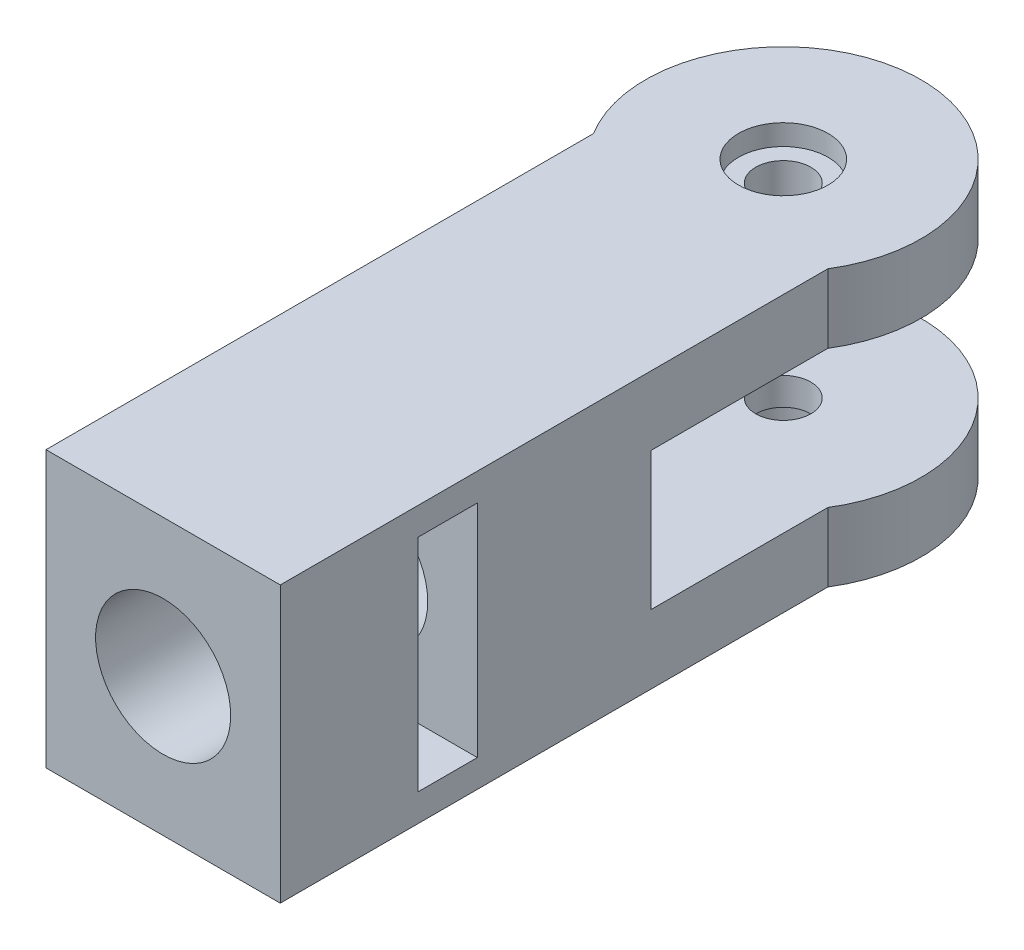
from build123d import *

# Parameters (mm, degrees)
SKETCH_1_W               = 17
SKETCH_1_H               = 20
EXTRUDE_1_DEPTH          = 40
SKETCH_3_R               = 10
SKETCH_3_R_2             = 2
EXTRUDE_2_DEPTH          = 10
EXTRUDE_START            = -5
SKETCH_4_R               = 10
SKETCH_4_R_2             = 2
EXTRUDE_3_DEPTH          = 5
SKETCH_5_R               = 20
CUT_EXTRUDE_1_DEPTH      = 10
CUT_EXTRUDE_2_REACH      = 66.858
CUT_EXTRUDE_2_END_RADIUS = 20
SKETCH_6_R               = 4.9
CUT_EXTRUDE_3_REACH      = 53.865
SKETCH_7_W               = 4.3
SKETCH_7_H               = 16
SKETCH_8_R               = 3.25
CUT_EXTRUDE_4_DEPTH      = 3
CUT_EXTRUDE_START        = -1.5
SKETCH_9_R               = 3.25
CUT_EXTRUDE_5_DEPTH      = 1.5


with BuildPart() as part:
    # 草图1 → 凸台-拉伸1 (new body)
    with BuildSketch(Plane.XY):
        with Locations((-10.828446216, -17.343796091)):
            Rectangle(SKETCH_1_W, SKETCH_1_H)
    extrude(amount=EXTRUDE_1_DEPTH)

    # 草图3 → 凸台-拉伸2 (add)
    with BuildSketch(Plane.XZ.offset(27.343796091)):
        with Locations((-10.828446216, -5)):
            Circle(SKETCH_3_R)
        with Locations(Location((-10.828446216, -5, 0), (0, 0, 270))):
            Circle(SKETCH_3_R_2, mode=Mode.SUBTRACT)
    extrude(amount=-EXTRUDE_2_DEPTH)

    # 草图4 → 凸台-拉伸3 (add)
    with BuildSketch(Plane(origin=(0, -7.343796091, 0), x_dir=(1, 0, 0), z_dir=(0, 1, 0)).offset(EXTRUDE_START)):
        with Locations((-10.828446216, 5)):
            Circle(SKETCH_4_R)
        with Locations(Location((-10.828446216, 5, 0), (0, 0, 90))):
            Circle(SKETCH_4_R_2, mode=Mode.SUBTRACT)
    extrude(amount=EXTRUDE_3_DEPTH)

    # 草图5 → 切除-拉伸1 (cut)
    with BuildSketch(Plane.XZ.offset(12.343796091)):
        with Locations((-10.828446216, -5)):
            Circle(SKETCH_5_R)
    extrude(amount=CUT_EXTRUDE_1_DEPTH, mode=Mode.SUBTRACT)

    # 切除-拉伸2: up to this cylinder (the profile starts outside it)
    cut_extrude_2_end = Plane(origin=(-10.828446216, -17.343796, -5), z_dir=(0, 1, 0)) * Cylinder(CUT_EXTRUDE_2_END_RADIUS, 174.716, mode=Mode.PRIVATE)
    # 草图6 → 切除-拉伸2 (cut, up to the surface)
    with BuildSketch(Plane.XY.offset(40), mode=Mode.PRIVATE) as cut_extrude_2_sk1:
        with Locations((-10.828446216, -17.343796091)):
            Circle(SKETCH_6_R)
    cut_extrude_2_tool1 = extrude(cut_extrude_2_sk1.sketch, amount=-CUT_EXTRUDE_2_REACH, mode=Mode.PRIVATE) - cut_extrude_2_end
    add(cut_extrude_2_tool1.solids().sort_by_distance((-10.828446, -17.343796, 40))[0], mode=Mode.SUBTRACT)

    # 草图7 → 切除-拉伸3 (cut, up to next)
    with BuildSketch(Plane(origin=(-2.328446216, 0, 0), x_dir=(0, 0, -1), z_dir=(1, 0, 0)), mode=Mode.PRIVATE) as cut_extrude_3_sk1:
        with Locations((-27.85, -17.343796091)):
            Rectangle(SKETCH_7_W, SKETCH_7_H)
    cut_extrude_3_tool1 = extrude(cut_extrude_3_sk1.sketch, amount=-CUT_EXTRUDE_3_REACH, mode=Mode.PRIVATE) & part.part
    add(cut_extrude_3_tool1.solids().sort_by_distance((-2.328446, -17.343796, 27.85))[0], mode=Mode.SUBTRACT)

    # 草图8 → 切除-拉伸4 (cut)
    with BuildSketch(Plane.XZ.offset(27.343796091)):
        with Locations(Location((-10.828446216, -5, 0), (0, 0, 270))):
            Circle(SKETCH_8_R)
    extrude(amount=-CUT_EXTRUDE_4_DEPTH, mode=Mode.SUBTRACT)

    # 草图9 → 切除-拉伸5 (cut)
    with BuildSketch(Plane(origin=(0, -7.343796091, 0), x_dir=(1, 0, 0), z_dir=(0, 1, 0)).offset(CUT_EXTRUDE_START)):
        with Locations(Location((-10.828446216, 5, 0), (0, 0, 90))):
            Circle(SKETCH_9_R)
    extrude(amount=CUT_EXTRUDE_5_DEPTH, mode=Mode.SUBTRACT)


solid = part.part
